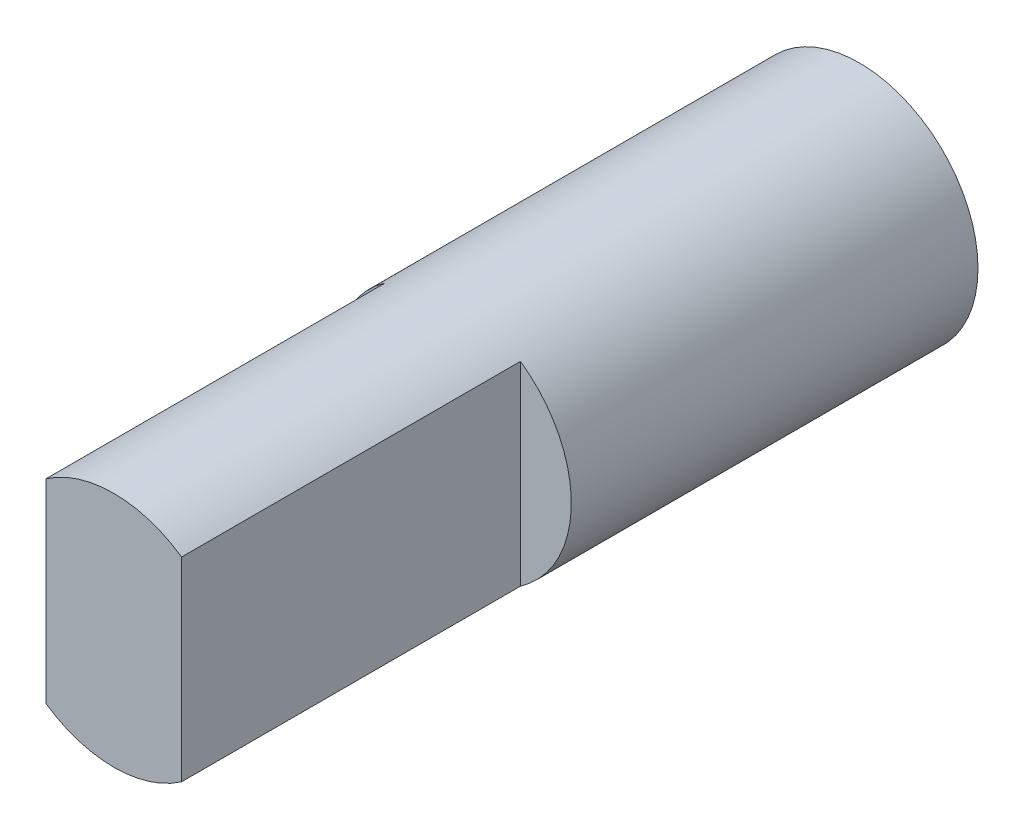
from build123d import *

# Parameters (mm, degrees)
CROQUIS1_R                 = 1.75
SALIENTE_EXTRUIR1_DEPTH    = 11
CORTAR_EXTRUIR1_DEPTH      = 1.75
CORTAR_EXTRUIR1_DEPTH_BACK = 1.75
CROQUIS2_W                 = 0.75
CROQUIS2_H                 = 5


with BuildPart() as part:
    # Croquis1 → Saliente-Extruir1 (new body)
    with BuildSketch(Plane.XY):
        Circle(CROQUIS1_R)
    extrude(amount=SALIENTE_EXTRUIR1_DEPTH)

    # Croquis2 → Cortar-Extruir1 (cut, two sides: drawn at the far end of the back side and taken through both)
    with BuildSketch(Plane(origin=(0, 0, 0), x_dir=(1, 0, 0), z_dir=(0, 1, 0)).offset(-CORTAR_EXTRUIR1_DEPTH_BACK)):
        with Locations((-1.375, -8.5)):
            Rectangle(CROQUIS2_W, CROQUIS2_H)
        with Locations((1.375, -8.5)):
            Rectangle(CROQUIS2_W, CROQUIS2_H)
    extrude(amount=CORTAR_EXTRUIR1_DEPTH + CORTAR_EXTRUIR1_DEPTH_BACK, mode=Mode.SUBTRACT)


solid = part.part
